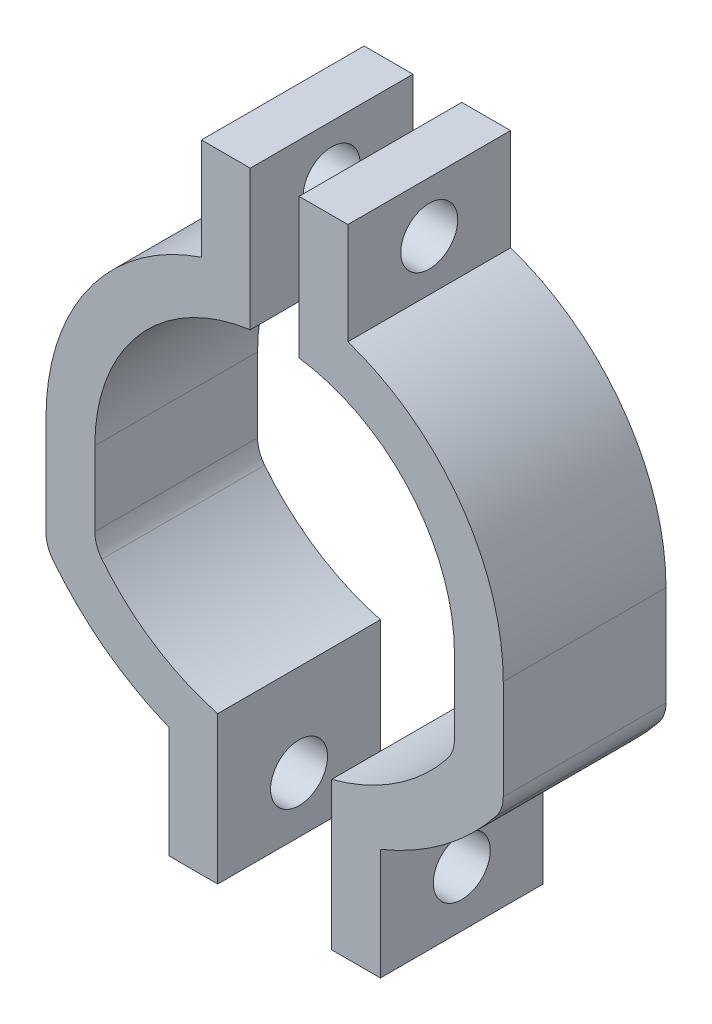
from build123d import *

# Parameters (mm, degrees)
BOSS_EXTRUDE1_DEPTH   = 10
BOSS_EXTRUDE1_2_DEPTH = 10
SKETCH3_R             = 1.75
CUT_EXTRUDE1_DEPTH    = 9
SKETCH2_R             = 1.75
CUT_EXTRUDE2_DEPTH    = 13


with BuildPart() as part:
    # Sketch1 → Boss-Extrude1 (new body)
    with BuildSketch(Plane.XY):
        with BuildLine():
            Line((-3.5, -19.55), (-3.5, -13.607075365))
            Line((-3.5, -13.607075365), (-3.5, -10.481054336))
            ThreePointArc((-3.5, -10.481054336), (-7.432970717, -8.721935391), (-10.615639418, -5.817907487))
            ThreePointArc((-10.615639418, -5.817907487), (-10.938290078, -5.232470693), (-11.05, -4.573410314))
            Line((-11.05, -4.573410314), (-11.05, 0))
            ThreePointArc((-11.05, 0), (-8.326989252, 7.263866051), (-1.5, 10.947716657))
            Line((-1.5, 10.947716657), (-1.5, 19.55))
            Line((-1.5, 19.55), (-4.5, 19.55))
            Line((-4.5, 19.55), (-4.5, 13.309864763))
            ThreePointArc((-4.5, 13.309864763), (-11.415504807, 8.190772247), (-14.05, 0))
            Line((-14.05, 0), (-14.05, -6.13172008))
            ThreePointArc((-14.05, -6.13172008), (-13.939041457, -6.788623705), (-13.618477627, -7.372638261))
            ThreePointArc((-13.618477627, -7.372638261), (-10.406069333, -10.500191535), (-6.5, -12.701050206))
            Line((-6.5, -12.701050206), (-6.5, -19.55))
            Line((-6.5, -19.55), (-3.5, -19.55))
        make_face()
    extrude(amount=BOSS_EXTRUDE1_DEPTH)


with BuildPart() as body_2:
    # Sketch1 → Boss-Extrude1 2 (new body)
    with BuildSketch(Plane.XY):
        with BuildLine():
            Line((3.5, -19.55), (3.5, -13.607075365))
            Line((3.5, -13.607075365), (3.5, -10.481054336))
            ThreePointArc((3.5, -10.481054336), (7.432970717, -8.721935391), (10.615639418, -5.817907487))
            ThreePointArc((10.615639418, -5.817907487), (10.938290078, -5.232470693), (11.05, -4.573410314))
            Line((11.05, -4.573410314), (11.05, 0))
            ThreePointArc((11.05, 0), (8.326989252, 7.263866051), (1.5, 10.947716657))
            Line((1.5, 10.947716657), (1.5, 19.55))
            Line((1.5, 19.55), (4.5, 19.55))
            Line((4.5, 19.55), (4.5, 13.309864763))
            ThreePointArc((4.5, 13.309864763), (11.415504807, 8.190772247), (14.05, 0))
            Line((14.05, 0), (14.05, -6.13172008))
            ThreePointArc((14.05, -6.13172008), (13.939041457, -6.788623705), (13.618477627, -7.372638261))
            ThreePointArc((13.618477627, -7.372638261), (10.406069333, -10.500191535), (6.5, -12.701050206))
            Line((6.5, -12.701050206), (6.5, -19.55))
            Line((6.5, -19.55), (3.5, -19.55))
        make_face()
    extrude(amount=BOSS_EXTRUDE1_2_DEPTH)


with BuildPart() as cut_extrude1_tool:
    # Sketch3 → Cut-Extrude1 (new body)
    with BuildSketch(Plane(origin=(4.5, 0, 0), x_dir=(0, 0, -1), z_dir=(1, 0, 0))):
        with Locations((-5, 16.429932381)):
            Circle(SKETCH3_R)
    extrude(amount=-CUT_EXTRUDE1_DEPTH)


with BuildPart() as part_1:
    add(part.part)

    # Cut-Extrude1: cut by cut_extrude1_tool
    add(cut_extrude1_tool.part, mode=Mode.SUBTRACT)


with BuildPart() as body_2_1:
    add(body_2.part)

    # Cut-Extrude1: cut by cut_extrude1_tool
    add(cut_extrude1_tool.part, mode=Mode.SUBTRACT)


with BuildPart() as cut_extrude2_tool:
    # Sketch2 → Cut-Extrude2 (new body)
    with BuildSketch(Plane(origin=(6.5, 0, 0), x_dir=(0, 0, -1), z_dir=(1, 0, 0))):
        with Locations((-5, -16.125525103)):
            Circle(SKETCH2_R)
    extrude(amount=-CUT_EXTRUDE2_DEPTH)


with BuildPart() as part_2:
    add(part_1.part)

    # Cut-Extrude2: cut by cut_extrude2_tool
    add(cut_extrude2_tool.part, mode=Mode.SUBTRACT)


with BuildPart() as body_2_2:
    add(body_2_1.part)

    # Cut-Extrude2: cut by cut_extrude2_tool
    add(cut_extrude2_tool.part, mode=Mode.SUBTRACT)


solid = Compound([part_2.part, body_2_2.part])
